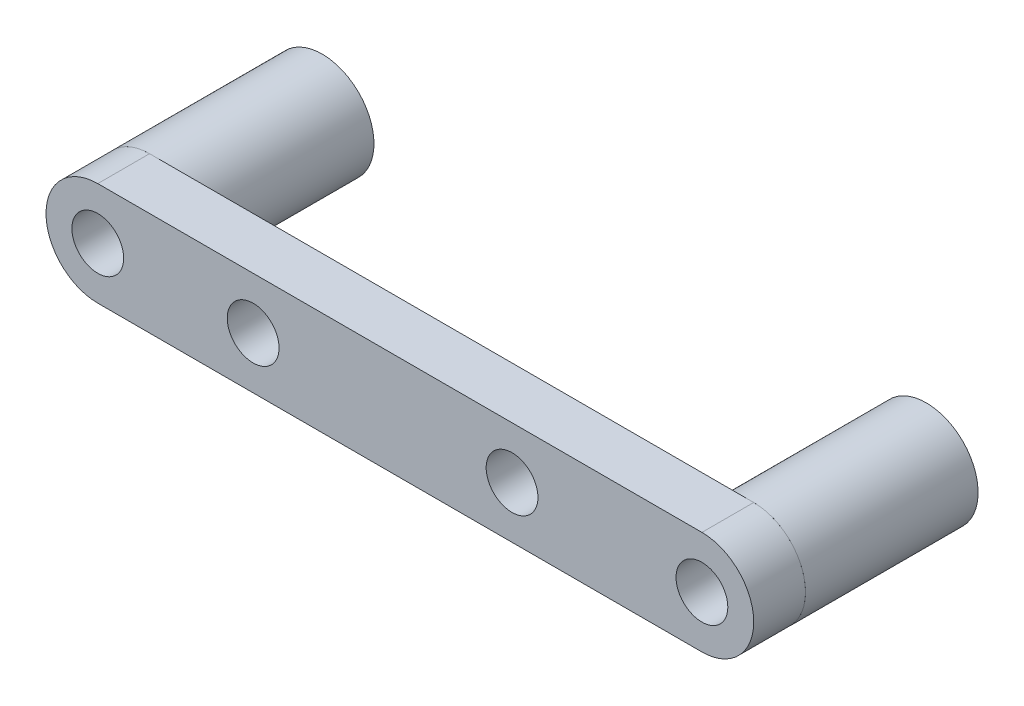
from build123d import *

# Parameters (mm, degrees)
SKETCH_1_R        = 1.5
EXTRUDE_1_DEPTH   = 3
EXTRUDE_START     = -3
SKETCH_2_R        = 1.5
EXTRUDE_2_DEPTH   = 3
SKETCH_3_R        = 3
SKETCH_3_R_2      = 1.5
EXTRUDE_3_DEPTH   = 10
EXTRUDE_3_2_DEPTH = 10


with BuildPart() as part:
    # ｽｹｯﾁ1 → ﾎﾞｽ - 押し出し1 (new body)
    with BuildSketch(Plane.XY):
        with BuildLine():
            Line((-7.5, 3), (7.5, 3))
            ThreePointArc((7.5, 3), (10.5, 0), (7.5, -3))
            Line((7.5, -3), (-7.5, -3))
            ThreePointArc((-7.5, -3), (-10.5, 0), (-7.5, 3))
        make_face()
        with Locations((-7.5, 0)):
            Circle(SKETCH_1_R, mode=Mode.SUBTRACT)
        with Locations((7.5, 0)):
            Circle(SKETCH_1_R, mode=Mode.SUBTRACT)
    extrude(amount=EXTRUDE_1_DEPTH)

    # ｽｹｯﾁ2 → ﾎﾞｽ - 押し出し2 (add)
    # profile 1 of 2: a face of its own
    with BuildSketch(Plane.XY.offset(3).offset(EXTRUDE_START)):
        with BuildLine():
            Line((-7.5, 3), (-16.5, 3))
            ThreePointArc((-16.5, 3), (-19.5, 0), (-16.5, -3))
            Line((-16.5, -3), (-7.5, -3))
            ThreePointArc((-7.5, -3), (-10.5, 0), (-7.5, 3))
        make_face()
        with Locations((-16.5, 0)):
            Circle(SKETCH_2_R, mode=Mode.SUBTRACT)
    # profile 2 of 2: a face of its own
    with BuildSketch(Plane.XY.offset(3).offset(EXTRUDE_START)):
        with BuildLine():
            Line((7.5, 3), (18.5, 3))
            ThreePointArc((18.5, 3), (21.5, 0), (18.5, -3))
            Line((18.5, -3), (7.5, -3))
            ThreePointArc((7.5, -3), (10.5, 0), (7.5, 3))
        make_face()
        with Locations((18.5, 0)):
            Circle(SKETCH_2_R, mode=Mode.SUBTRACT)
    extrude(amount=EXTRUDE_2_DEPTH)


with BuildPart() as body_2:
    # ｽｹｯﾁ3 → ﾎﾞｽ - 押し出し3 (new body)
    with BuildSketch(Plane(origin=(0, 0, 0), x_dir=(-1, 0, 0), z_dir=(0, 0, -1))):
        with Locations((16.5, 0)):
            Circle(SKETCH_3_R)
        with Locations((16.5, 0)):
            Circle(SKETCH_3_R_2, mode=Mode.SUBTRACT)
    extrude(amount=EXTRUDE_3_DEPTH)


with BuildPart() as body_3:
    # ｽｹｯﾁ3 → Extrude 3 2 (new body)
    with BuildSketch(Plane(origin=(0, 0, 0), x_dir=(-1, 0, 0), z_dir=(0, 0, -1))):
        with Locations((-18.5, 0)):
            Circle(SKETCH_3_R)
        with Locations((-18.5, 0)):
            Circle(SKETCH_3_R_2, mode=Mode.SUBTRACT)
    extrude(amount=EXTRUDE_3_2_DEPTH)


solid = Compound([part.part, body_2.part, body_3.part])
